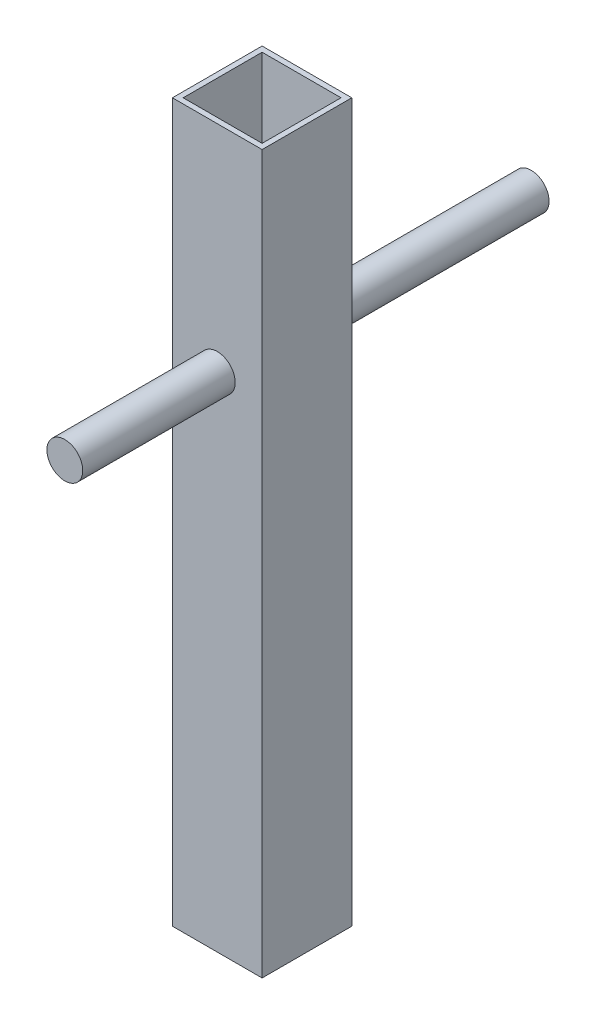
from build123d import *

# Parameters (mm, degrees)
SKETCH3_W                = 25
SKETCH3_H                = 25
SKETCH3_W_2              = 22
SKETCH3_H_2              = 22
BOSS_EXTRUDE1_DEPTH      = 200
SKETCH4_R                = 5
CUT_EXTRUDE1_DEPTH       = 25
BOSS_EXTRUDE2_DEPTH      = 55
BOSS_EXTRUDE2_DEPTH_BACK = 75
SKETCH5_R                = 5


with BuildPart() as part:
    # Sketch3 → Boss-Extrude1 (new body)
    with BuildSketch(Plane(origin=(0, 0, 0), x_dir=(1, 0, 0), z_dir=(0, 1, 0))):
        Rectangle(SKETCH3_W, SKETCH3_H)
        Rectangle(SKETCH3_W_2, SKETCH3_H_2, mode=Mode.SUBTRACT)
    extrude(amount=BOSS_EXTRUDE1_DEPTH)

    # Sketch4 → Cut-Extrude1 (cut)
    with BuildSketch(Plane.XY.offset(12.5)):
        with Locations((0, 140)):
            Circle(SKETCH4_R)
    extrude(amount=-CUT_EXTRUDE1_DEPTH, mode=Mode.SUBTRACT)

    # Sketch5 → Boss-Extrude2 (add, two sides: drawn at the far end of the back side and taken through both)
    with BuildSketch(Plane.XY.offset(-BOSS_EXTRUDE2_DEPTH_BACK)):
        with Locations((0, 140)):
            Circle(SKETCH5_R)
    extrude(amount=BOSS_EXTRUDE2_DEPTH + BOSS_EXTRUDE2_DEPTH_BACK)


solid = part.part
